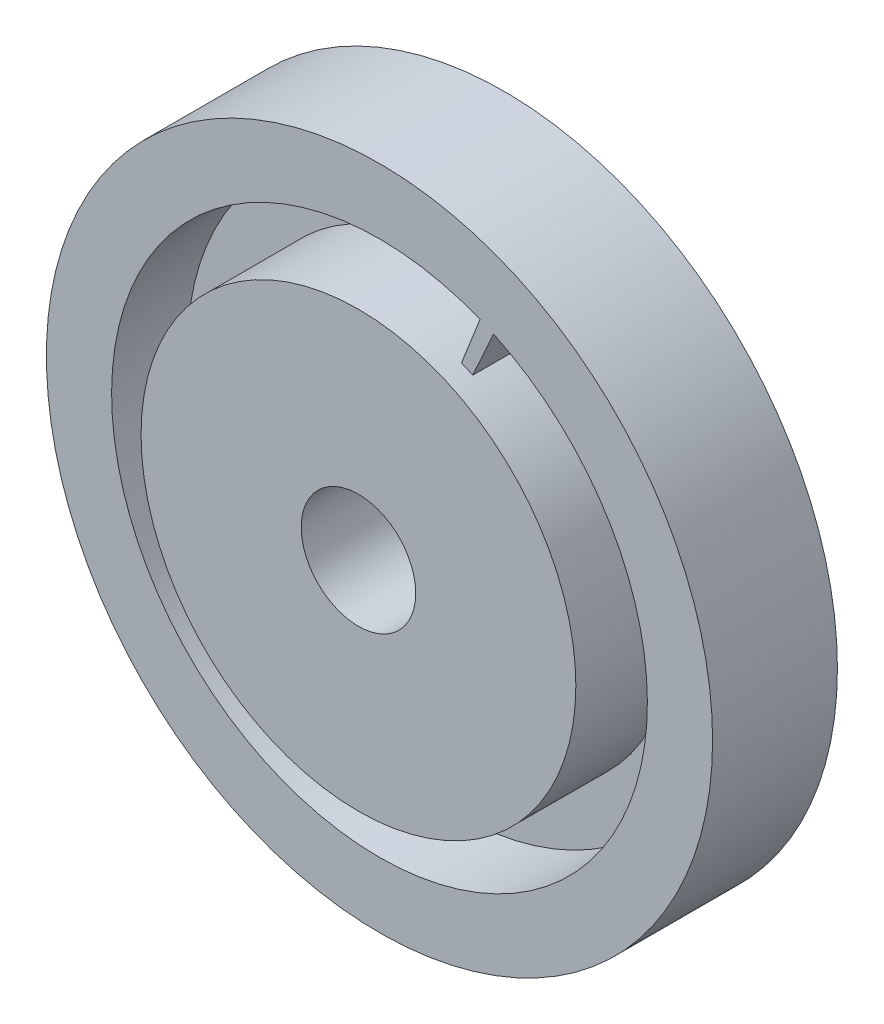
from build123d import *

# Parameters (mm, degrees)
SKETCH1_R           = 23.75
BOSS_EXTRUDE1_DEPTH = 8.9
SKETCH3_R           = 15.5
BOSS_EXTRUDE2_DEPTH = 10.4
CUT_EXTRUDE1_START  = 5.4
CUT_EXTRUDE1_DEPTH  = 5.4
CUT_EXTRUDE2_REACH  = 37.161
SKETCH5_R           = 4.08


with BuildPart() as part:
    # Sketch1 → Boss-Extrude1 (new body)
    with BuildSketch(Plane.XY):
        Circle(SKETCH1_R)
    extrude(amount=BOSS_EXTRUDE1_DEPTH)

    # Sketch3 → Boss-Extrude2 (add)
    with BuildSketch(Plane(origin=(0, 0, 0), x_dir=(-1, 0, 0), z_dir=(0, 0, -1))):
        Circle(SKETCH3_R)
    extrude(amount=-BOSS_EXTRUDE2_DEPTH)

    # Sketch4 → Cut-Extrude1 (cut)
    with BuildSketch(Plane(origin=(0, 0, 8.9), x_dir=(-1, 0, 0), z_dir=(0, 0, -1)).offset(CUT_EXTRUDE1_START)):
        with BuildLine():
            Line((-5.848746097, 14.354169049), (-7.167594485, 17.704112214))
            ThreePointArc((-7.167594485, 17.704112214), (7.650920777, -17.50066888), (-8.128479811, 17.284033556))
            Line((-8.128479811, 17.284033556), (-6.648360671, 14.001760617))
            ThreePointArc((-6.648360671, 14.001760617), (6.251037299, -14.183600836), (-5.848746097, 14.354169049))
        make_face()
    extrude(amount=-CUT_EXTRUDE1_DEPTH, mode=Mode.SUBTRACT)

    # Sketch5 → Cut-Extrude2 (cut, up to next)
    with BuildSketch(Plane.XY.offset(10.4), mode=Mode.PRIVATE) as cut_extrude2_sk1:
        Circle(SKETCH5_R)
    cut_extrude2_tool1 = extrude(cut_extrude2_sk1.sketch, amount=-CUT_EXTRUDE2_REACH, mode=Mode.PRIVATE) & part.part
    add(cut_extrude2_tool1.solids().sort_by_distance((0, 0, 10.4))[0], mode=Mode.SUBTRACT)


solid = part.part
